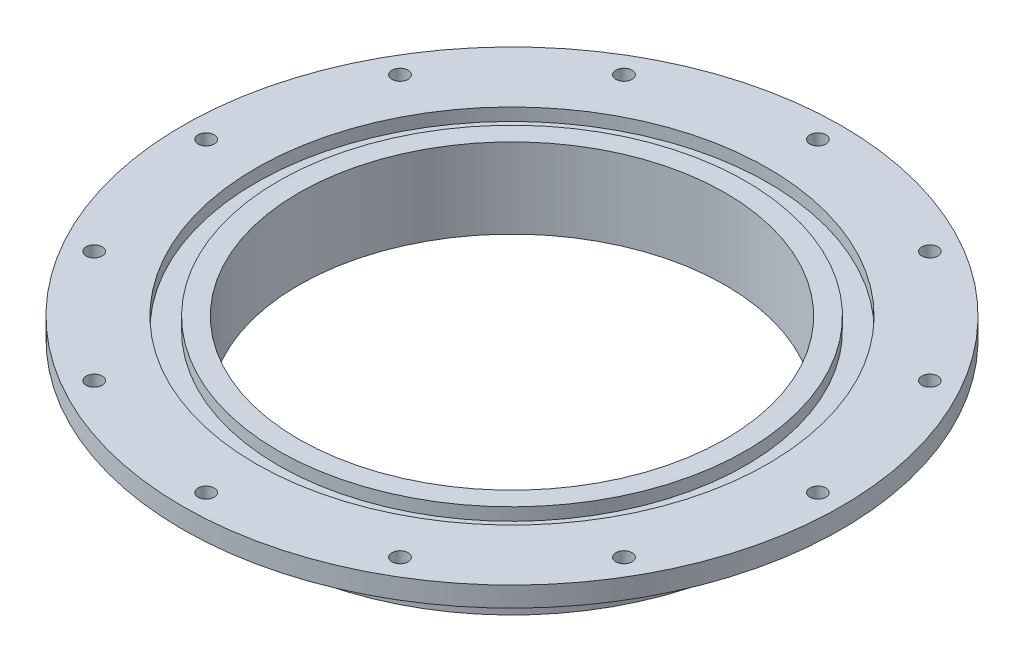
from build123d import *

# Parameters (mm, degrees)
SKETCH1_R               = 80.518
SKETCH1_R_2             = 67.818
INNER_CYLINDER_DEPTH    = 19.05
SKETCH2_R               = 104.775
SKETCH2_R_2             = 67.818
FLANGE_DEPTH            = 6.35
SKETCH4_R               = 81.407
SKETCH4_R_2             = 74.295
GROOVE_DEPTH            = 3.9878
SKETCH5_R               = 2.5527
SCREW_HOLES_DEPTH       = 6.35
CIRPATTERN1_COUNT       = 12
CUT_EXTRUDE1_DEPTH      = 3.6068
CUT_EXTRUDE1_DEPTH_BACK = 3.6068
SKETCH7_R               = 80.518
SKETCH7_R_2             = 76.1746


with BuildPart() as part:
    # Sketch1 → Inner Cylinder (new body)
    with BuildSketch(Plane(origin=(0, 0, 0), x_dir=(1, 0, 0), z_dir=(0, 1, 0))):
        with Locations(Location((0, 0, 0), (0, 0, 90))):
            Circle(SKETCH1_R)
        with Locations(Location((0, 0, 0), (0, 0, 90))):
            Circle(SKETCH1_R_2, mode=Mode.SUBTRACT)
    extrude(amount=INNER_CYLINDER_DEPTH)

    # Sketch2 → Flange (add)
    with BuildSketch(Plane(origin=(0, 19.05, 0), x_dir=(1, 0, 0), z_dir=(0, 1, 0))):
        with Locations(Location((0, 0, 0), (0, 0, 270))):
            Circle(SKETCH2_R)
        with Locations(Location((0, 0, 0), (0, 0, 90))):
            Circle(SKETCH2_R_2, mode=Mode.SUBTRACT)
    extrude(amount=FLANGE_DEPTH)

    # Sketch4 → Groove (cut)
    with BuildSketch(Plane(origin=(0, 25.4, 0), x_dir=(1, 0, 0), z_dir=(0, 1, 0))):
        with Locations(Location((0, 0, 0), (0, 0, 270))):
            Circle(SKETCH4_R)
        with Locations(Location((0, 0, 0), (0, 0, 270))):
            Circle(SKETCH4_R_2, mode=Mode.SUBTRACT)
    extrude(amount=-GROOVE_DEPTH, mode=Mode.SUBTRACT)

    # Sketch5 → Screw Holes (cut)
    with BuildSketch(Plane(origin=(0, 25.4, 0), x_dir=(1, 0, 0), z_dir=(0, 1, 0))):
        with Locations(Location((0, -97.25025, 0), (0, 0, 270))):
            Circle(SKETCH5_R)
    screw_holes = extrude(amount=-SCREW_HOLES_DEPTH, mode=Mode.SUBTRACT)

    # CirPattern1: Screw Holes ×12 about axis
    cirpattern1_axis = Axis((0, 0, 0), (0, 1, 0))
    for i in range(1, CIRPATTERN1_COUNT):
        add(screw_holes.rotate(cirpattern1_axis, i * 360 / CIRPATTERN1_COUNT), mode=Mode.SUBTRACT)

    # Sketch7 → Cut-Extrude1 (cut, two sides: drawn at the far end of the back side and taken through both)
    with BuildSketch(Plane(origin=(0, 9.525, 0), x_dir=(-1, 0, 0), z_dir=(0, -1, 0)).offset(-CUT_EXTRUDE1_DEPTH_BACK)):
        with Locations(Location((0, 0, 0), (0, 0, 90))):
            Circle(SKETCH7_R)
        with Locations(Location((0, 0, 0), (0, 0, 90))):
            Circle(SKETCH7_R_2, mode=Mode.SUBTRACT)
    extrude(amount=CUT_EXTRUDE1_DEPTH + CUT_EXTRUDE1_DEPTH_BACK, mode=Mode.SUBTRACT)


solid = part.part
